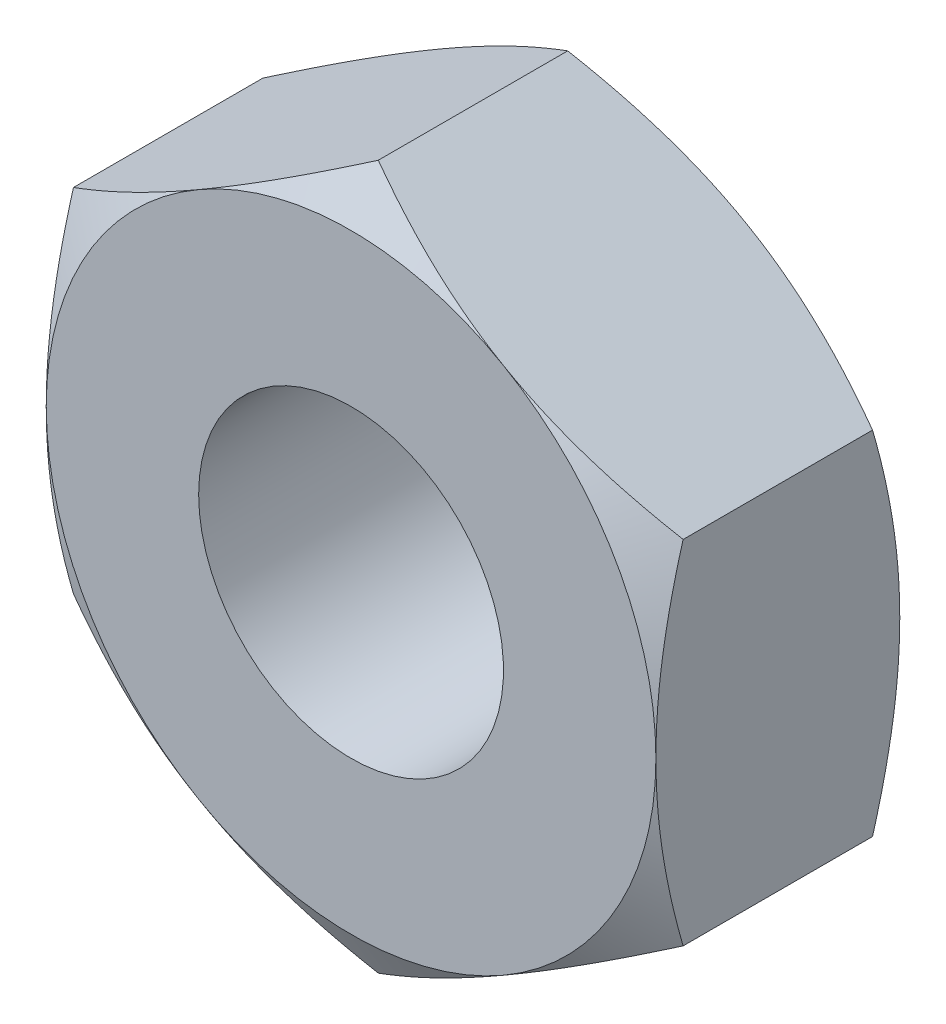
from build123d import *

# Parameters (mm, degrees)
EXTRUDE1_DEPTH          = 0.8
SKETCH13_R              = 1
BOSS_EXTRUDE1_DEPTH     = 1.6
SKETCH7_OUTSIDE_W       = 95.252
SKETCH7_OUTSIDE_H       = 95.87
SKETCH7_OUTSIDE_R       = 2
EXTRUDE2_DEPTH          = 25.4
EXTRUDE2_DRAFT          = -60
MIRROR2_COPY_1_SKETCH_W = 95.252
MIRROR2_COPY_1_SKETCH_H = 95.87
MIRROR2_COPY_1_SKETCH_R = 2
MIRROR2_COPY_1_DEPTH    = 25.4
MIRROR2_COPY_1_DRAFT    = -60


with BuildPart() as part:
    # Sketch1 → Extrude1 (new, symmetric)
    with BuildSketch(Plane.XY):
        Polygon((-2, 1.154700538), (-2, -1.154700538), (0, -2.309401077), (2, -1.154700538), (2, 1.154700538), (0, 2.309401077), align=None)
    extrude(amount=EXTRUDE1_DEPTH, both=True)

    # Cut-Extrude2 cone 1 section (through the dimple's axis) → Cut-Extrude2 (revolve, cut)
    with BuildSketch(Plane(origin=(0, 0, 0.8), x_dir=(0, -1, 0), z_dir=(1, 0, 0))):
        Polygon((0, 0), (1, 0), (0, 1), align=None)
    revolve(axis=Axis((0, 0, 0.8), (0, 0, -1)), mode=Mode.SUBTRACT)

    # Cut-Extrude3 cone 1 section (through the dimple's axis) → Cut-Extrude3 (revolve, cut)
    with BuildSketch(Plane(origin=(0, 0, -0.8), x_dir=(0, 1, 0), z_dir=(1, 0, 0))):
        Polygon((0, 0), (1, 0), (0, 1), align=None)
    revolve(axis=Axis((0, 0, -0.8), (0, 0, 1)), mode=Mode.SUBTRACT)


with BuildPart() as body_2:
    # Sketch13 → Boss-Extrude1 (new body)
    with BuildSketch(Plane(origin=(0, 0, -0.8), x_dir=(-1, 0, 0), z_dir=(0, 0, -1))):
        Circle(SKETCH13_R)
    extrude(amount=-BOSS_EXTRUDE1_DEPTH)


with BuildPart() as part_1:
    add(part.part)

    # Combine1: cut body 2
    add(body_2.part, mode=Mode.SUBTRACT)


with BuildPart() as extrude2_tool:
    # Sketch7 outside → Extrude2 (with draft: the straight prism first)
    with BuildSketch(Plane.XY.offset(0.8)):
        Rectangle(SKETCH7_OUTSIDE_W, SKETCH7_OUTSIDE_H)
        Circle(SKETCH7_OUTSIDE_R, mode=Mode.SUBTRACT)
    extrude(amount=-EXTRUDE2_DEPTH)
    # Extrude2: the draft: its side faces are tilted about the plane it starts from
    extrude2_sides = [extrude2_tool.faces().sort_by_distance(p)[0] for p in [
        (0, -47.935, -11.9),
        (47.626, 0, -11.9),
        (0, 47.935, -11.9),
        (-47.626, 0, -11.9),
        (-2, 0, -11.9),
    ]]
    draft(extrude2_sides, Plane.XY.offset(0.8), EXTRUDE2_DRAFT)


with BuildPart() as part_2:
    add(part_1.part)

    # Extrude2: cut by extrude2_tool
    add(extrude2_tool.part, mode=Mode.SUBTRACT)


with BuildPart() as mirror2_copy_1_tool:
    # Mirror2 copy 1 sketch → Mirror2 copy 1 (with draft: the straight prism first)
    with BuildSketch(Plane(origin=(0, 0, -0.8), x_dir=(1, 0, 0), z_dir=(0, 0, -1))):
        Rectangle(MIRROR2_COPY_1_SKETCH_W, MIRROR2_COPY_1_SKETCH_H)
        Circle(MIRROR2_COPY_1_SKETCH_R, mode=Mode.SUBTRACT)
    extrude(amount=-MIRROR2_COPY_1_DEPTH)
    # Mirror2 copy 1: the draft: its side faces are tilted about the plane it starts from
    mirror2_copy_1_sides = [mirror2_copy_1_tool.faces().sort_by_distance(p)[0] for p in [
        (0, -47.935, 11.9),
        (47.626, 0, 11.9),
        (0, 47.935, 11.9),
        (-47.626, 0, 11.9),
        (-2, 0, 11.9),
    ]]
    draft(mirror2_copy_1_sides, Plane(origin=(0, 0, -0.8), x_dir=(1, 0, 0), z_dir=(0, 0, -1)), MIRROR2_COPY_1_DRAFT)


with BuildPart() as part_3:
    add(part_2.part)

    # Mirror2 copy 1: cut by mirror2_copy_1_tool
    add(mirror2_copy_1_tool.part, mode=Mode.SUBTRACT)


solid = part_3.part
